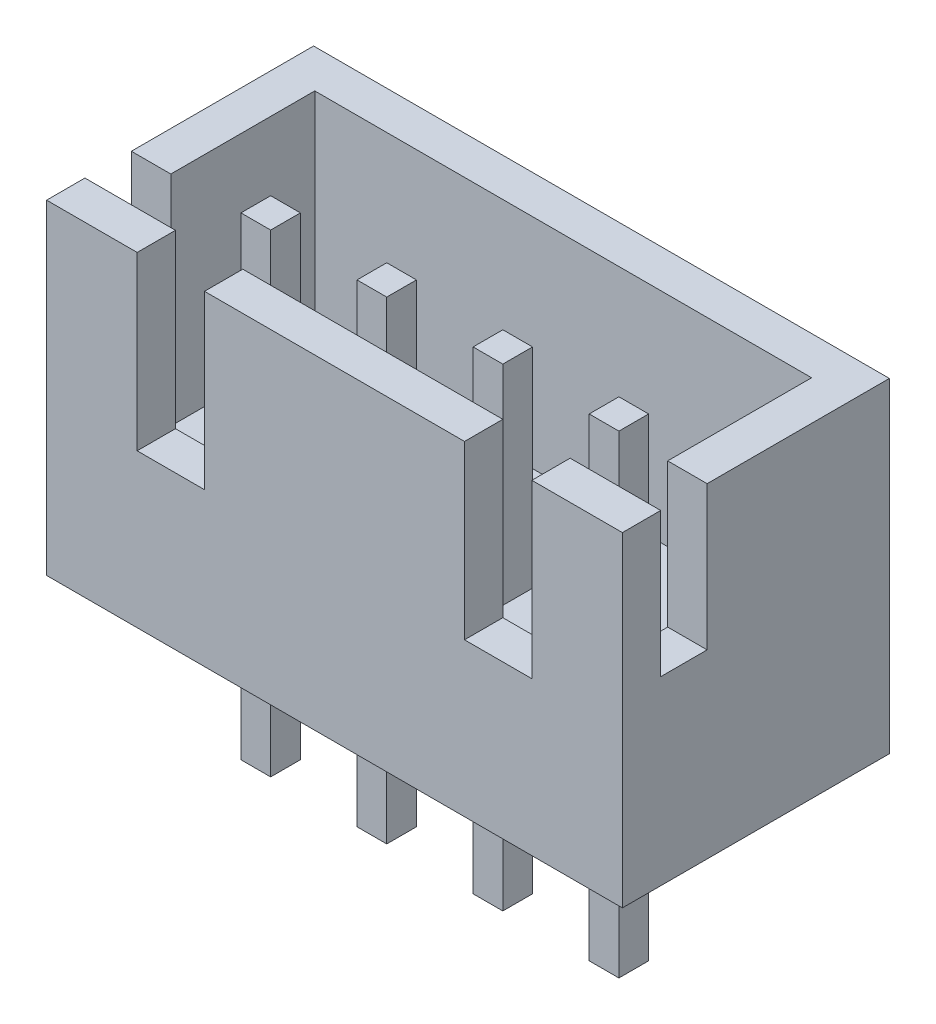
from build123d import *

# Parameters (mm, degrees)
SKETCH1_W           = 12.4
SKETCH1_H           = 7
BOSS_EXTRUDE1_DEPTH = 5.75
SKETCH2_W           = 1
SKETCH2_H           = 3.1
CUT_EXTRUDE1_DEPTH  = 15.526721068
SKETCH3_W           = 10.7
SKETCH3_H           = 1
CUT_EXTRUDE2_DEPTH  = 1.6
SKETCH4_W           = 10.7
SKETCH4_H           = 4.7
CUT_EXTRUDE3_DEPTH  = 3.1
SKETCH5_W           = 1.45
SKETCH5_H           = 3.7
CUT_EXTRUDE4_DEPTH  = 11.568615094
SKETCH6_W           = 1.45
SKETCH6_H           = 3.7
CUT_EXTRUDE5_DEPTH  = 11.568615094
SKETCH7_W           = 0.64
SKETCH7_H           = 0.64
BOSS_EXTRUDE2_DEPTH = 4.5
SKETCH8_W           = 0.64
SKETCH8_H           = 0.64
BOSS_EXTRUDE3_DEPTH = 4.5
SKETCH9_W           = 0.64
SKETCH9_H           = 0.64
BOSS_EXTRUDE4_DEPTH = 4.5
SKETCH10_W          = 0.64
SKETCH10_H          = 0.64
BOSS_EXTRUDE5_DEPTH = 4.5
SKETCH11_W          = 0.64
SKETCH11_H          = 0.64
BOSS_EXTRUDE6_DEPTH = 3.4
SKETCH12_W          = 0.64
SKETCH12_H          = 0.64
BOSS_EXTRUDE7_DEPTH = 3.4
SKETCH13_W          = 0.64
SKETCH13_H          = 0.64
BOSS_EXTRUDE8_DEPTH = 3.4
SKETCH14_W          = 0.64
SKETCH14_H          = 0.64
BOSS_EXTRUDE9_DEPTH = 3.4


with BuildPart() as part:
    # Sketch1 → Boss-Extrude1 (new body)
    with BuildSketch(Plane.XY.offset(2.875)):
        with Locations((0, 3.5)):
            Rectangle(SKETCH1_W, SKETCH1_H)
    extrude(amount=-BOSS_EXTRUDE1_DEPTH)

    # Sketch2 → Cut-Extrude1 (cut, through all)
    with BuildSketch(Plane.ZY.offset(6.2)):
        with Locations((1.55, 5.45)):
            Rectangle(SKETCH2_W, SKETCH2_H)
    extrude(amount=-CUT_EXTRUDE1_DEPTH, mode=Mode.SUBTRACT)

    # Sketch3 → Cut-Extrude2 (cut)
    with BuildSketch(Plane(origin=(0, 3.9, 0), x_dir=(-1, 0, 0), z_dir=(0, 1, 0))):
        with Locations((0, 1.55)):
            Rectangle(SKETCH3_W, SKETCH3_H)
    extrude(amount=-CUT_EXTRUDE2_DEPTH, mode=Mode.SUBTRACT)

    # Sketch4 → Cut-Extrude3 (cut)
    with BuildSketch(Plane.XY.offset(1.05)):
        with Locations((0, 4.65)):
            Rectangle(SKETCH4_W, SKETCH4_H)
    extrude(amount=-CUT_EXTRUDE3_DEPTH, mode=Mode.SUBTRACT)

    # Sketch5 → Cut-Extrude4 (cut, through all)
    with BuildSketch(Plane(origin=(0, 0, 2.05), x_dir=(-1, 0, 0), z_dir=(0, 0, -1))):
        with Locations((-3.525, 5.15)):
            Rectangle(SKETCH5_W, SKETCH5_H)
    extrude(amount=-CUT_EXTRUDE4_DEPTH, mode=Mode.SUBTRACT)

    # Sketch6 → Cut-Extrude5 (cut, through all)
    with BuildSketch(Plane(origin=(0, 0, 2.05), x_dir=(-1, 0, 0), z_dir=(0, 0, -1))):
        with Locations((3.525, 5.15)):
            Rectangle(SKETCH6_W, SKETCH6_H)
    extrude(amount=-CUT_EXTRUDE5_DEPTH, mode=Mode.SUBTRACT)

    # Sketch7 → Boss-Extrude2 (add)
    with BuildSketch(Plane(origin=(0, 2.3, 0), x_dir=(-1, 0, 0), z_dir=(0, 1, 0))):
        with Locations((1.25, 0.5)):
            Rectangle(SKETCH7_W, SKETCH7_H)
    extrude(amount=BOSS_EXTRUDE2_DEPTH)

    # Sketch8 → Boss-Extrude3 (add)
    with BuildSketch(Plane(origin=(0, 2.3, 0), x_dir=(-1, 0, 0), z_dir=(0, 1, 0))):
        with Locations((-3.75, 0.5)):
            Rectangle(SKETCH8_W, SKETCH8_H)
    extrude(amount=BOSS_EXTRUDE3_DEPTH)

    # Sketch9 → Boss-Extrude4 (add)
    with BuildSketch(Plane(origin=(0, 2.3, 0), x_dir=(-1, 0, 0), z_dir=(0, 1, 0))):
        with Locations((-1.25, 0.5)):
            Rectangle(SKETCH9_W, SKETCH9_H)
    extrude(amount=BOSS_EXTRUDE4_DEPTH)

    # Sketch10 → Boss-Extrude5 (add)
    with BuildSketch(Plane(origin=(0, 2.3, 0), x_dir=(-1, 0, 0), z_dir=(0, 1, 0))):
        with Locations((3.75, 0.5)):
            Rectangle(SKETCH10_W, SKETCH10_H)
    extrude(amount=BOSS_EXTRUDE5_DEPTH)

    # Sketch11 → Boss-Extrude6 (add)
    with BuildSketch(Plane.XZ):
        with Locations((-1.25, 0.5)):
            Rectangle(SKETCH11_W, SKETCH11_H)
    extrude(amount=BOSS_EXTRUDE6_DEPTH)

    # Sketch12 → Boss-Extrude7 (add)
    with BuildSketch(Plane.XZ):
        with Locations((3.75, 0.5)):
            Rectangle(SKETCH12_W, SKETCH12_H)
    extrude(amount=BOSS_EXTRUDE7_DEPTH)

    # Sketch13 → Boss-Extrude8 (add)
    with BuildSketch(Plane.XZ):
        with Locations((1.25, 0.5)):
            Rectangle(SKETCH13_W, SKETCH13_H)
    extrude(amount=BOSS_EXTRUDE8_DEPTH)

    # Sketch14 → Boss-Extrude9 (add)
    with BuildSketch(Plane.XZ):
        with Locations((-3.75, 0.5)):
            Rectangle(SKETCH14_W, SKETCH14_H)
    extrude(amount=BOSS_EXTRUDE9_DEPTH)


solid = part.part
